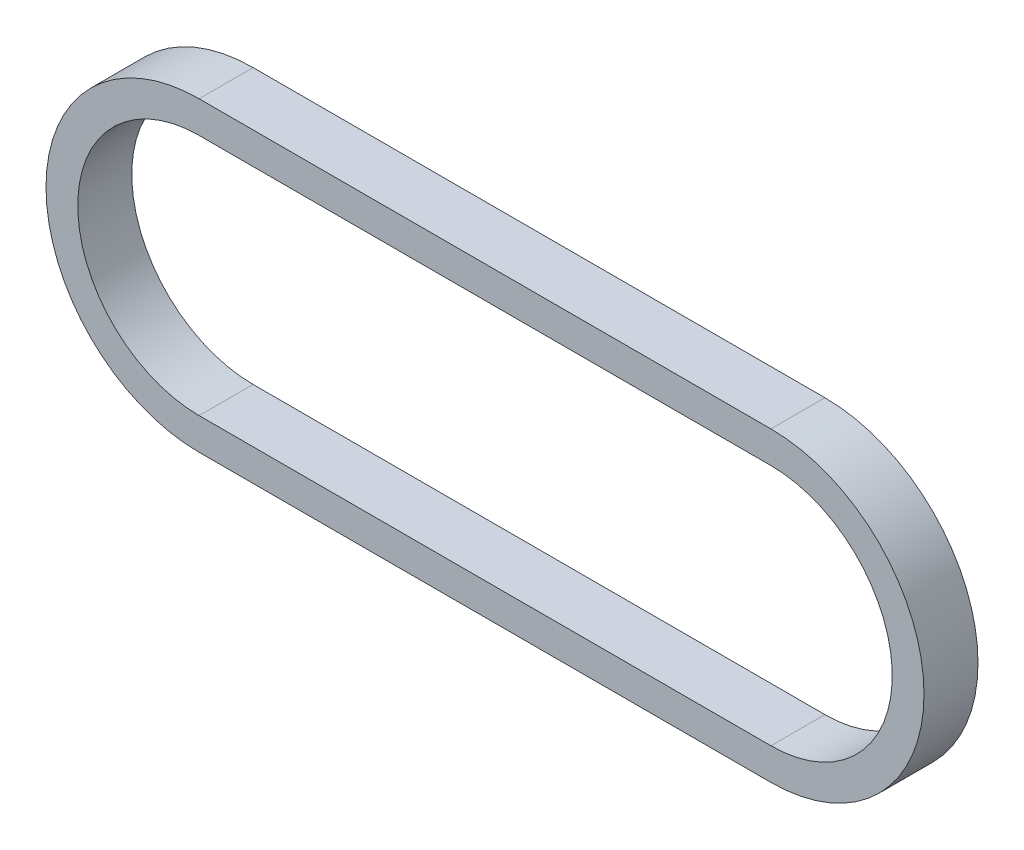
from build123d import *

# Parameters (mm, degrees)
EXTRUDE_THIN1_DEPTH = 4.25


with BuildPart() as part:
    # Sketch1 → Extrude-Thin1 (new, symmetric)
    with BuildSketch(Plane.XY):
        with BuildLine():
            Line((45.01261, -24.1008), (-45.01261, -24.1008))
            ThreePointArc((-45.01261, -24.1008), (-69.11341, 0), (-45.01261, 24.1008))
            Line((-45.01261, 24.1008), (45.01261, 24.1008))
            ThreePointArc((45.01261, 24.1008), (69.11341, 0), (45.01261, -24.1008))
        make_face()
        with BuildLine():
            Line((45.01261, -19.1008), (-45.01261, -19.1008))
            ThreePointArc((-45.01261, -19.1008), (-64.11341, 0), (-45.01261, 19.1008))
            Line((-45.01261, 19.1008), (45.01261, 19.1008))
            ThreePointArc((45.01261, 19.1008), (64.11341, 0), (45.01261, -19.1008))
        make_face(mode=Mode.SUBTRACT)
    extrude(amount=EXTRUDE_THIN1_DEPTH, both=True)


solid = part.part
